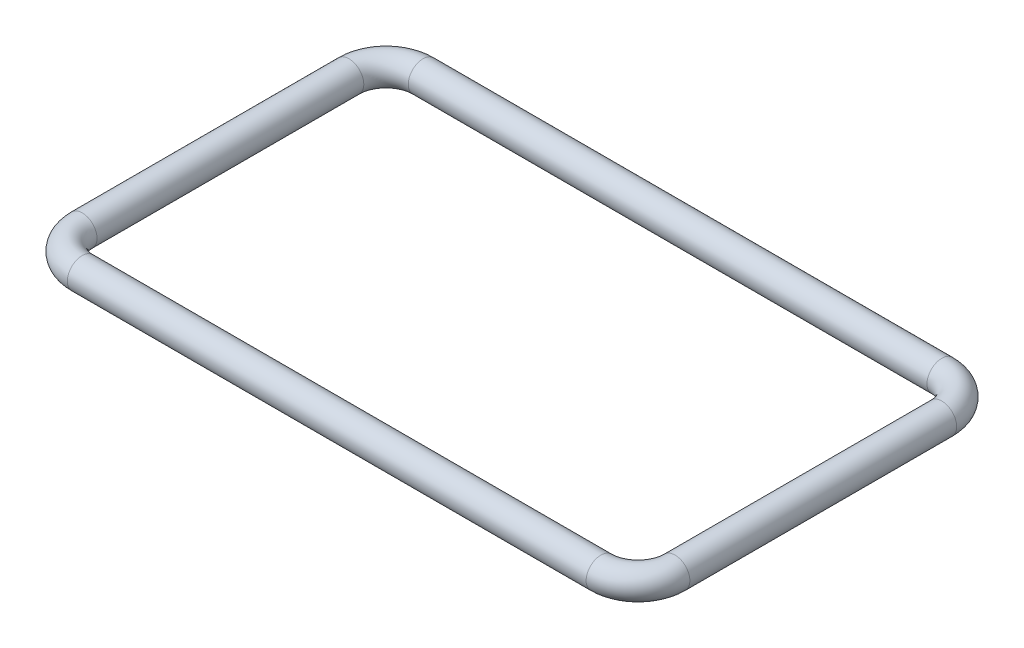
from build123d import *

# Parameters (mm, degrees)
SWEEP3_PROFILE_R = 1.27


with BuildPart() as part:
    # Sweep3: sweep along a path in Sketch1
    with BuildLine(Plane(origin=(0, 0, 0), x_dir=(1, 0, 0), z_dir=(0, 1, 0))) as sweep3_path:
        Line((0, 0), (-22.225, 0))
        ThreePointArc((-22.225, 0), (-24.47006403, 0.92993597), (-25.4, 3.175))
        Line((-25.4, 3.175), (-25.4, 26.035))
        ThreePointArc((-25.4, 26.035), (-24.47006403, 28.28006403), (-22.225, 29.21))
        Line((-22.225, 29.21), (0, 29.21))
    # Sweep3 profile (on start of the path) → Sweep3 (sweep)
    with BuildSketch(Plane(origin=(0, 0, 0), x_dir=(0, 0, -1), z_dir=(-1, 0, 0))):
        Circle(SWEEP3_PROFILE_R)
    sweep3 = sweep(path=sweep3_path.line)

    # Mirror1: Sweep3 across plane
    add(sweep3.mirror(Plane(origin=(0, 0, 0), x_dir=(0, 0, 1), z_dir=(1, 0, 0))))


solid = part.part
